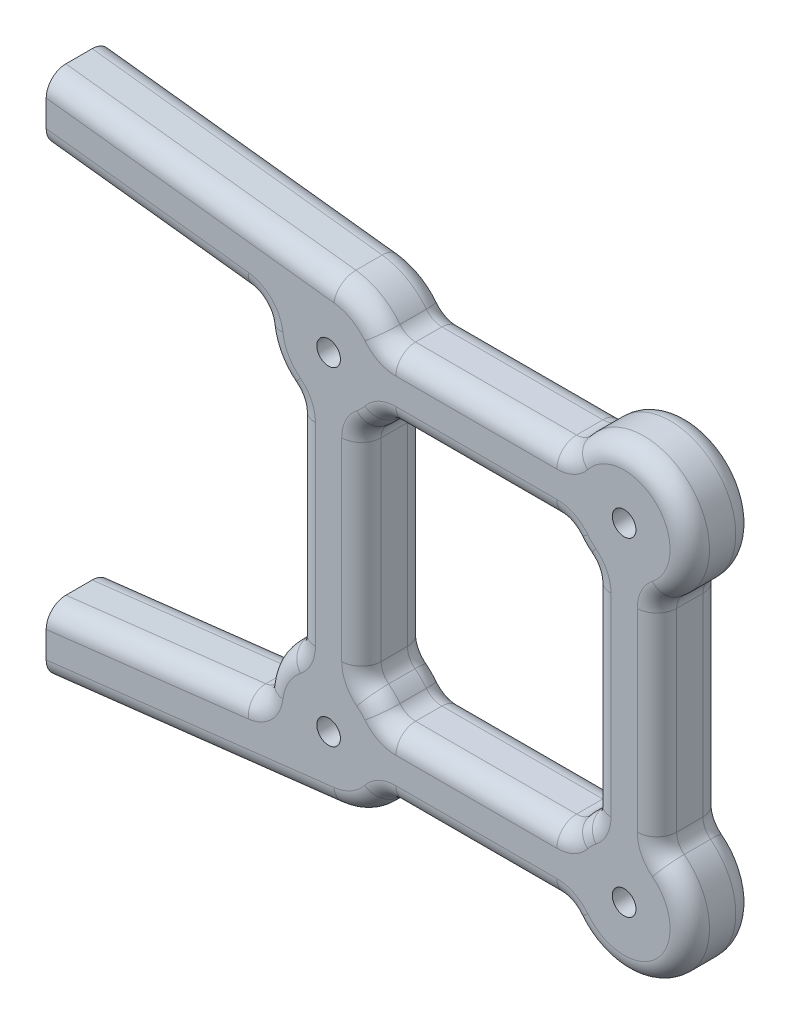
from build123d import *

# Parameters (mm, degrees)
BOSS_EXTRUDE1_DEPTH            = 10
FILLET1_R                      = 3
FILLET2_R                      = 3
SKETCH2_R                      = 2.075
CUT_EXTRUDE1_DEPTH             = 7
CBORE_FOR_M3_SHCS1_D           = 3.6
CBORE_FOR_M3_SHCS1_CBORE_D     = 6.5
CBORE_FOR_M3_SHCS1_CBORE_DEPTH = 3


with BuildPart() as part:
    # Sketch1 → Boss-Extrude1 (new body)
    with BuildSketch(Plane(origin=(0, 0, 0), x_dir=(0, 1, 0), z_dir=(0, 0, 1))):
        with BuildLine():
            Line((-16.339745962, 27.5), (16.339745962, 27.5))
            ThreePointArc((16.339745962, 27.5), (20.509345078, 31.434988437), (26.155008582, 32.433073803))
            Line((26.155008582, 32.433073803), (30, 65.5))
            Line((30, 65.5), (40.067377126, 65.5))
            Line((40.067377126, 65.5), (34.933073803, 21.344991418))
            ThreePointArc((34.933073803, 21.344991418), (33.35651546, 17.007400492), (30, 13.839745962))
            Line((30, 13.839745962), (30, -13.839745962))
            ThreePointArc((30, -13.839745962), (32.071067812, -29.571067812), (16.339745962, -27.5))
            Line((16.339745962, -27.5), (-16.339745962, -27.5))
            ThreePointArc((-16.339745962, -27.5), (-32.071067812, -29.571067812), (-30, -13.839745962))
            Line((-30, -13.839745962), (-30, 13.839745962))
            ThreePointArc((-30, 13.839745962), (-33.35651546, 17.007400492), (-34.933073803, 21.344991418))
            Line((-34.933073803, 21.344991418), (-40.067377126, 65.5))
            Line((-40.067377126, 65.5), (-30, 65.5))
            Line((-30, 65.5), (-26.155008582, 32.433073803))
            ThreePointArc((-26.155008582, 32.433073803), (-20.509345078, 31.434988437), (-16.339745962, 27.5))
        make_face()
        with BuildLine():
            Line((-16.339745962, 17.5), (16.339745962, 17.5))
            ThreePointArc((16.339745962, 17.5), (17.928932188, 15.428932188), (20, 13.839745962))
            Line((20, 13.839745962), (20, -13.839745962))
            ThreePointArc((20, -13.839745962), (17.928932188, -15.428932188), (16.339745962, -17.5))
            Line((16.339745962, -17.5), (-16.339745962, -17.5))
            ThreePointArc((-16.339745962, -17.5), (-17.928932188, -15.428932188), (-20, -13.839745962))
            Line((-20, -13.839745962), (-20, 13.839745962))
            ThreePointArc((-20, 13.839745962), (-17.928932188, 15.428932188), (-16.339745962, 17.5))
        make_face(mode=Mode.SUBTRACT)
    extrude(amount=BOSS_EXTRUDE1_DEPTH)

    # Fillet1
    fillet1_edges = [part.edges().sort_by_distance(p)[0] for p in [
        (-27.5, -16.339745962, 5),
        (-27.5, 16.339745962, 5),
        (-32.433073803, 26.155008582, 5),
        (-13.839745962, 30, 5),
        (13.839745962, 30, 5),
        (27.5, 16.339745962, 5),
        (27.5, -16.339745962, 5),
        (13.839745962, -30, 5),
        (-13.839745962, -30, 5),
        (-32.433073803, -26.155008582, 5),
        (-17.5, -16.339745962, 5),
        (-13.839745962, -20, 5),
        (13.839745962, -20, 5),
        (17.5, -16.339745962, 5),
        (17.5, 16.339745962, 5),
        (13.839745962, 20, 5),
        (-13.839745962, 20, 5),
        (-17.5, 16.339745962, 5),
    ]]
    fillet(fillet1_edges, radius=FILLET1_R)

    # Fillet2
    fillet2_edges = [part.edges().sort_by_distance(p)[0] for p in [
        (-31.215136241, 20.096287091, 0),
        (-31.215136241, 20.096287091, 10),
        (-27.5, 0, 0),
        (-27.5, 0, 10),
        (-31.215136241, -20.096287091, 0),
        (-31.215136241, -20.096287091, 10),
        (-50.282227477, -28.230491567, 0),
        (-50.282227477, -28.230491567, 10),
        (0, -30, 0),
        (0, -30, 10),
        (29.571067812, -32.071067812, 0),
        (29.571067812, -32.071067812, 10),
        (27.5, 0, 0),
        (27.5, 0, 10),
        (-17.196151103, 16.068636263, 0),
        (-17.196151103, 16.068636263, 10),
        (-13.568636263, 19.696151103, 0),
        (-13.568636263, 19.696151103, 10),
        (13.568636263, 19.696151103, 0),
        (13.568636263, 19.696151103, 10),
        (17.196151103, 16.068636263, 0),
        (17.196151103, 16.068636263, 10),
        (17.196151103, -16.068636263, 0),
        (17.196151103, -16.068636263, 10),
        (13.568636263, -19.696151103, 0),
        (13.568636263, -19.696151103, 10),
        (-17.196151103, -16.068636263, 0),
        (-17.196151103, -16.068636263, 10),
        (-13.568636263, -19.696151103, 0),
        (-13.568636263, -19.696151103, 10),
        (-13.568636263, 30.303848897, 0),
        (-13.568636263, 30.303848897, 10),
        (13.568636263, 30.303848897, 0),
        (13.568636263, 30.303848897, 10),
        (-33.291069286, 25.603812472, 0),
        (-33.291069286, 25.603812472, 10),
        (-27.803848897, 16.068636263, 0),
        (-27.803848897, 16.068636263, 10),
        (-27.803848897, -16.068636263, 0),
        (-27.803848897, -16.068636263, 10),
        (-33.291069286, -25.603812472, 0),
        (-33.291069286, -25.603812472, 10),
        (-13.568636263, -30.303848897, 0),
        (-13.568636263, -30.303848897, 10),
        (13.568636263, -30.303848897, 0),
        (13.568636263, -30.303848897, 10),
        (27.803848897, -16.068636263, 0),
        (27.803848897, -16.068636263, 10),
        (27.803848897, 16.068636263, 0),
        (27.803848897, 16.068636263, 10),
        (-50.282227477, 28.230491567, 0),
        (-43.422495709, -37.500225465, 10),
        (-43.422495709, 37.500225465, 0),
        (-17.602169804, -33.718443632, 0),
        (-43.422495709, -37.500225465, 0),
        (-17.602169804, -33.718443632, 10),
        (-43.422495709, 37.500225465, 10),
        (-50.282227477, 28.230491567, 10),
        (-15.428932188, 17.928932188, 0),
        (-15.428932188, 17.928932188, 10),
        (-17.5, 0, 0),
        (-17.5, 0, 10),
        (0, 20, 0),
        (0, 20, 10),
        (15.428932188, 17.928932188, 0),
        (15.428932188, 17.928932188, 10),
        (17.5, 0, 0),
        (17.5, 0, 10),
        (15.428932188, -17.928932188, 0),
        (15.428932188, -17.928932188, 10),
        (0, -20, 0),
        (0, -20, 10),
        (-15.428932188, -17.928932188, 0),
        (-15.428932188, -17.928932188, 10),
        (-17.602169804, 33.718443632, 0),
        (-17.602169804, 33.718443632, 10),
        (0, 30, 0),
        (0, 30, 10),
        (29.571067812, 32.071067812, 0),
        (29.571067812, 32.071067812, 10),
    ]]
    fillet(fillet2_edges, radius=FILLET2_R)

    # Sketch2 → Cut-Extrude1 (cut)
    with BuildSketch(Plane(origin=(-65.5, 0, 0), x_dir=(0, -1, 0), z_dir=(-1, 0, 0))):
        with Locations(Location((34.067377126, 5, 0), (0, 0, 90))):
            Circle(SKETCH2_R)
        with Locations(Location((-34.067377126, 5, 0), (0, 0, 90))):
            Circle(SKETCH2_R)
    extrude(amount=-CUT_EXTRUDE1_DEPTH, mode=Mode.SUBTRACT)

    # CBORE for M3 SHCS1 (through all)
    with Locations(Plane(origin=(0, 0, 0), x_dir=(1, 0, 0), z_dir=(0, 0, -1))):
        with Locations((22.5, 25), (22.5, -25), (-22.5, -25), (-22.5, 25)):
            CounterBoreHole(CBORE_FOR_M3_SHCS1_D / 2, CBORE_FOR_M3_SHCS1_CBORE_D / 2, CBORE_FOR_M3_SHCS1_CBORE_DEPTH)


solid = part.part
